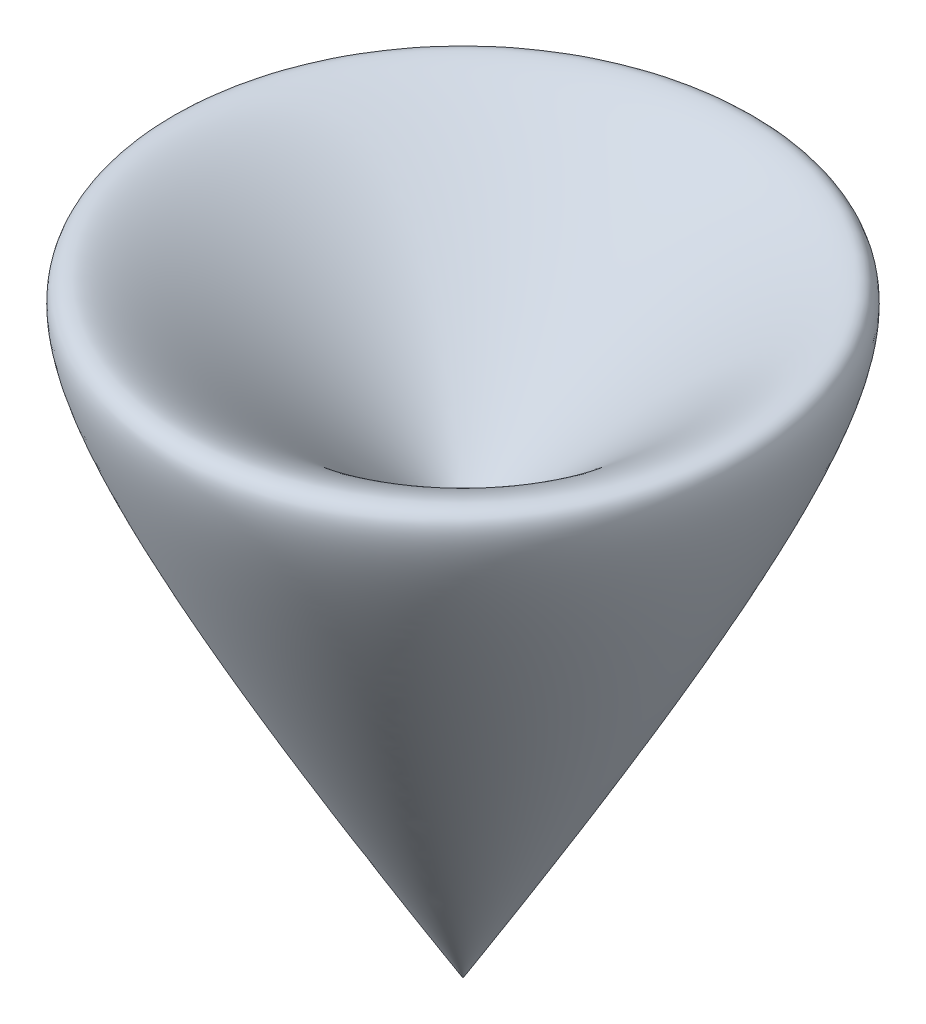
from build123d import *


with BuildPart() as part:
    # Sketch1 → Revolve1 (revolve)
    with BuildSketch(Plane.XY):
        with BuildLine():
            Line((0, -38.579237292), (0, 5.845338984))
            add(Edge.make_bspline(
                [(0, 5.845338984), (69.101390863, 76.364638869), (0, -38.579237292)],
                knots=[0, 0, 0, 1, 1, 1], degree=2))
        make_face()
    revolve(axis=Axis((0, 50.26991526, 0), (0, -1, 0)))


solid = part.part
